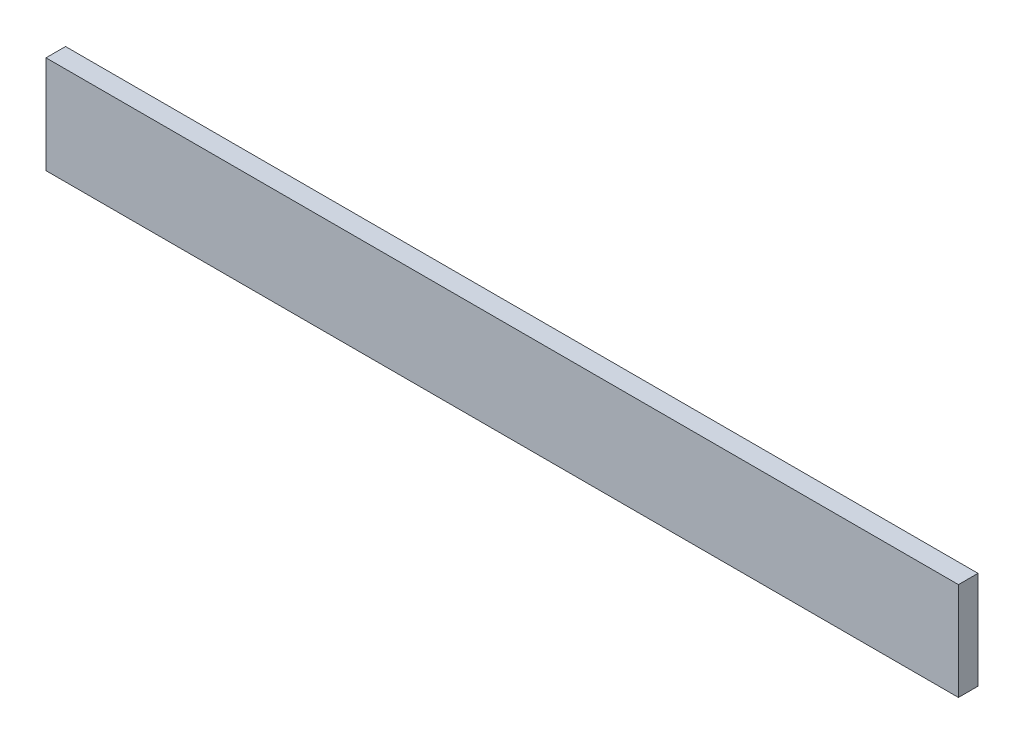
from build123d import *

# Parameters (mm, degrees)
SKETCH1_W           = 140
SKETCH1_H           = 15
BOSS_EXTRUDE1_DEPTH = 3


with BuildPart() as part:
    # Sketch1 → Boss-Extrude1 (new body)
    with BuildSketch(Plane.XY):
        Rectangle(SKETCH1_W, SKETCH1_H)
    extrude(amount=BOSS_EXTRUDE1_DEPTH)


solid = part.part
